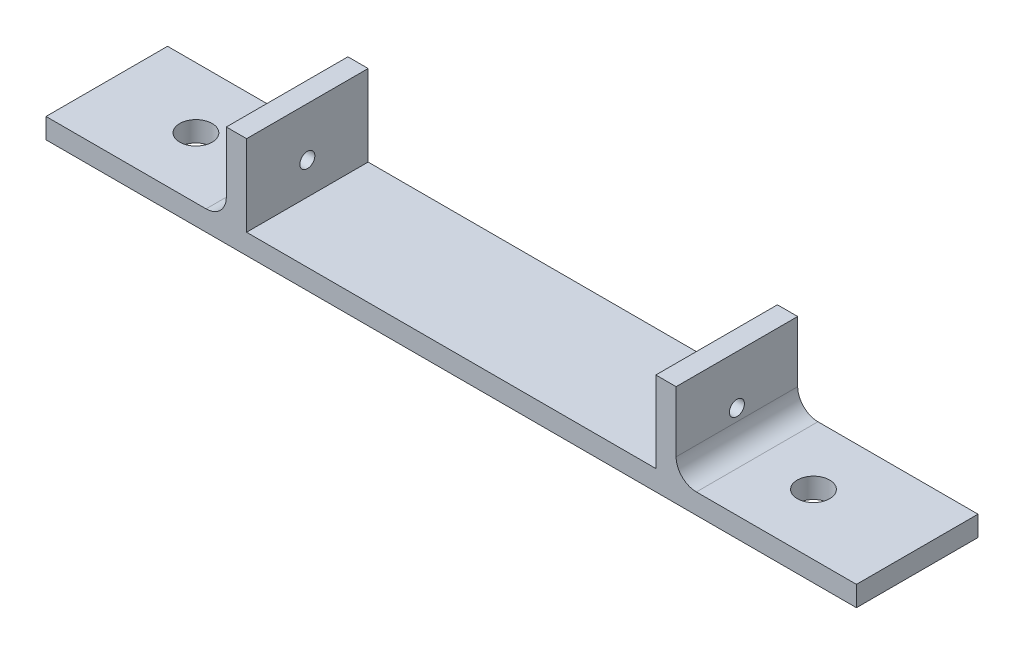
from build123d import *

# Parameters (mm, degrees)
SKETCH1_W           = 200
SKETCH1_H           = 30
BOSS_EXTRUDE1_DEPTH = 5
SKETCH2_W           = 5
SKETCH2_H           = 30
BOSS_EXTRUDE2_DEPTH = 20
FILLET1_R           = 5
SKETCH3_R           = 1.85
CUT_EXTRUDE2_DEPTH  = 159.209512988
SKETCH4_R           = 4
CUT_EXTRUDE3_DEPTH  = 104.07764064
SKETCH5_R           = 4
CUT_EXTRUDE4_DEPTH  = 104.07764064


with BuildPart() as part:
    # Sketch1 → Boss-Extrude1 (new body)
    with BuildSketch(Plane(origin=(0, 0, 0), x_dir=(1, 0, 0), z_dir=(0, 1, 0))):
        Rectangle(SKETCH1_W, SKETCH1_H)
    extrude(amount=BOSS_EXTRUDE1_DEPTH)

    # Sketch2 → Boss-Extrude2 (add)
    with BuildSketch(Plane(origin=(0, 5, 0), x_dir=(1, 0, 0), z_dir=(0, 1, 0))):
        with Locations((-53, 0)):
            Rectangle(SKETCH2_W, SKETCH2_H)
        with Locations((53, 0)):
            Rectangle(SKETCH2_W, SKETCH2_H)
    extrude(amount=BOSS_EXTRUDE2_DEPTH)

    # Fillet1
    fillet1_edges = [part.edges().sort_by_distance(p)[0] for p in [
        (-55.5, 5, 0),
        (55.5, 5, 0),
    ]]
    fillet(fillet1_edges, radius=FILLET1_R)

    # Sketch3 → Cut-Extrude2 (cut, through all)
    with BuildSketch(Plane.ZY.offset(55.5)):
        with Locations((0, 12.94)):
            Circle(SKETCH3_R)
    extrude(amount=-CUT_EXTRUDE2_DEPTH, mode=Mode.SUBTRACT)

    # Sketch4 → Cut-Extrude3 (cut, through all)
    with BuildSketch(Plane(origin=(0, 5, 0), x_dir=(1, 0, 0), z_dir=(0, 1, 0))):
        with Locations(Location((-78, 0, 0), (0, 0, 270))):
            Circle(SKETCH4_R)
    extrude(amount=-CUT_EXTRUDE3_DEPTH, mode=Mode.SUBTRACT)

    # Sketch5 → Cut-Extrude4 (cut, through all)
    with BuildSketch(Plane(origin=(0, 5, 0), x_dir=(1, 0, 0), z_dir=(0, 1, 0))):
        with Locations(Location((74.4, 0, 0), (0, 0, 270))):
            Circle(SKETCH5_R)
    extrude(amount=-CUT_EXTRUDE4_DEPTH, mode=Mode.SUBTRACT)


solid = part.part
